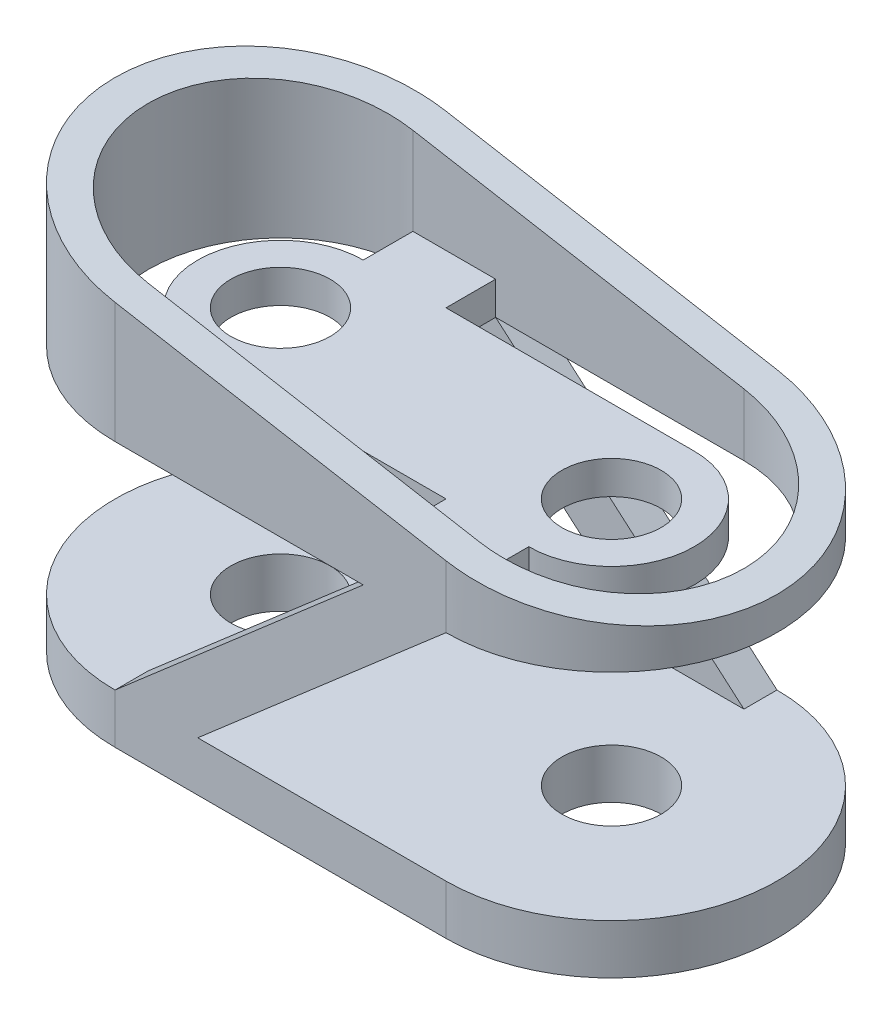
from build123d import *

# Parameters (mm, degrees)
BOSS_EXTRUDE1_DEPTH      = 15
SKETCH6_R                = 15
CUT_EXTRUDE2_DEPTH       = 113.805141727
BOSS_EXTRUDE2_START      = 80
BOSS_EXTRUDE2_DEPTH      = 10
BOSS_EXTRUDE3_DEPTH      = 10
BOSS_EXTRUDE4_DEPTH      = 10
SKETCH7_OUTSIDE_W        = 250.208
SKETCH7_OUTSIDE_H        = 150.208
CUT_EXTRUDE3_DEPTH       = 10
SKETCH9_R                = 15
CUT_EXTRUDE4_DEPTH       = 10
BOSS_EXTRUDE5_DEPTH      = 40
BOSS_EXTRUDE5_DEPTH_BACK = 10
CUT_EXTRUDE6_DEPTH       = 172.464281995
CUT_EXTRUDE6_DEPTH_BACK  = 172.464281995


with BuildPart() as part:
    # Sketch1 → Boss-Extrude1 (new body)
    with BuildSketch(Plane(origin=(0, 0, 0), x_dir=(1, 0, 0), z_dir=(0, 1, 0))):
        with BuildLine():
            Line((-50, 50), (50, 50))
            ThreePointArc((50, 50), (100, 0), (50, -50))
            Line((50, -50), (-50, -50))
            ThreePointArc((-50, -50), (-100, 0), (-50, 50))
        make_face()
    extrude(amount=BOSS_EXTRUDE1_DEPTH)

    # Sketch6 → Cut-Extrude2 (cut, through all)
    with BuildSketch(Plane(origin=(0, 15, 0), x_dir=(1, 0, 0), z_dir=(0, 1, 0))):
        with Locations((50, 0)):
            Circle(SKETCH6_R)
        with Locations((-50, 0)):
            Circle(SKETCH6_R)
    extrude(amount=-CUT_EXTRUDE2_DEPTH, mode=Mode.SUBTRACT)



with BuildPart() as body_2:
    # Sketch1<2> → Boss-Extrude2 (new body)
    with BuildSketch(Plane(origin=(0, 0, 0), x_dir=(1, 0, 0), z_dir=(0, 1, 0)).offset(BOSS_EXTRUDE2_START)):
        with BuildLine():
            Line((-50, 50), (50, 50))
            ThreePointArc((50, 50), (100, 0), (50, -50))
            Line((50, -50), (-50, -50))
            ThreePointArc((-50, -50), (-100, 0), (-50, 50))
        make_face()
    extrude(amount=BOSS_EXTRUDE2_DEPTH)


with BuildPart() as part_1:
    add(part.part)

    add(body_2.part)  # Boss-Extrude3 merges body 2
    # Sketch3 → Boss-Extrude3 (add)
    with BuildSketch(Plane.XY.offset(50)):
        Polygon((-50, 15), (25, 80), (50, 80), (-25, 15), align=None)
    extrude(amount=-BOSS_EXTRUDE3_DEPTH)

    # Sketch4 → Boss-Extrude4 (add)
    with BuildSketch(Plane(origin=(0, 0, -50), x_dir=(-1, 0, 0), z_dir=(0, 0, -1))):
        Polygon((-50, 15), (25, 80), (50, 80), (-25, 15), align=None)
    extrude(amount=-BOSS_EXTRUDE4_DEPTH)

    # Sketch7 outside → Cut-Extrude3 (cut)
    with BuildSketch(Plane(origin=(0, 90, 0), x_dir=(1, 0, 0), z_dir=(0, 1, 0))):
        Rectangle(SKETCH7_OUTSIDE_W, SKETCH7_OUTSIDE_H)
        with BuildLine():
            Line((-50, -25), (25, -25))
            Line((25, -25), (25, -50))
            Line((25, -50), (50, -50))
            Line((50, -50), (50, -25))
            ThreePointArc((50, -25), (75, 0), (50, 25))
            Line((50, 25), (-25, 25))
            Line((-25, 25), (-25, 50))
            Line((-25, 50), (-50, 50))
            Line((-50, 50), (-50, 25))
            ThreePointArc((-50, 25), (-75, 0), (-50, -25))
        make_face(mode=Mode.SUBTRACT)
    extrude(amount=-CUT_EXTRUDE3_DEPTH, mode=Mode.SUBTRACT)

    # Sketch9 → Cut-Extrude4 (cut)
    with BuildSketch(Plane(origin=(0, 90, 0), x_dir=(1, 0, 0), z_dir=(0, 1, 0))):
        with Locations((-50, 0)):
            Circle(SKETCH9_R)
        with Locations((50, 0)):
            Circle(SKETCH9_R)
    extrude(amount=-CUT_EXTRUDE4_DEPTH, mode=Mode.SUBTRACT)

    # Sketch10 → Boss-Extrude5 (add, two sides: drawn at the far end of the back side and taken through both)
    with BuildSketch(Plane(origin=(0, 90, 0), x_dir=(1, 0, 0), z_dir=(0, 1, 0)).offset(-BOSS_EXTRUDE5_DEPTH_BACK)):
        with BuildLine():
            ThreePointArc((-50, 50), (-100, 0), (-50, -50))
            Line((-50, -50), (50, -50))
            ThreePointArc((50, -50), (100, 0), (50, 50))
            Line((50, 50), (-50, 50))
        make_face()
        with BuildLine():
            ThreePointArc((-50, -40), (-90, 0), (-50, 40))
            Line((-50, 40), (50, 40))
            ThreePointArc((50, 40), (90, 0), (50, -40))
            Line((50, -40), (-50, -40))
        make_face(mode=Mode.SUBTRACT)
    extrude(amount=BOSS_EXTRUDE5_DEPTH + BOSS_EXTRUDE5_DEPTH_BACK)

    # Sketch14 → Cut-Extrude6 (cut, two sides: drawn at the far end of the back side and taken through both)
    with BuildSketch(Plane.XY.offset(-CUT_EXTRUDE6_DEPTH_BACK)):
        Polygon((613.52300147, -0.547960374), (100, 90), (-120.836171039, 128.93937527), (-634.359172509, 219.487335644), (-453.263251762, 1246.533338584), (794.618922217, 1026.498042567), align=None)
    extrude(amount=CUT_EXTRUDE6_DEPTH + CUT_EXTRUDE6_DEPTH_BACK, mode=Mode.SUBTRACT)


solid = part_1.part
